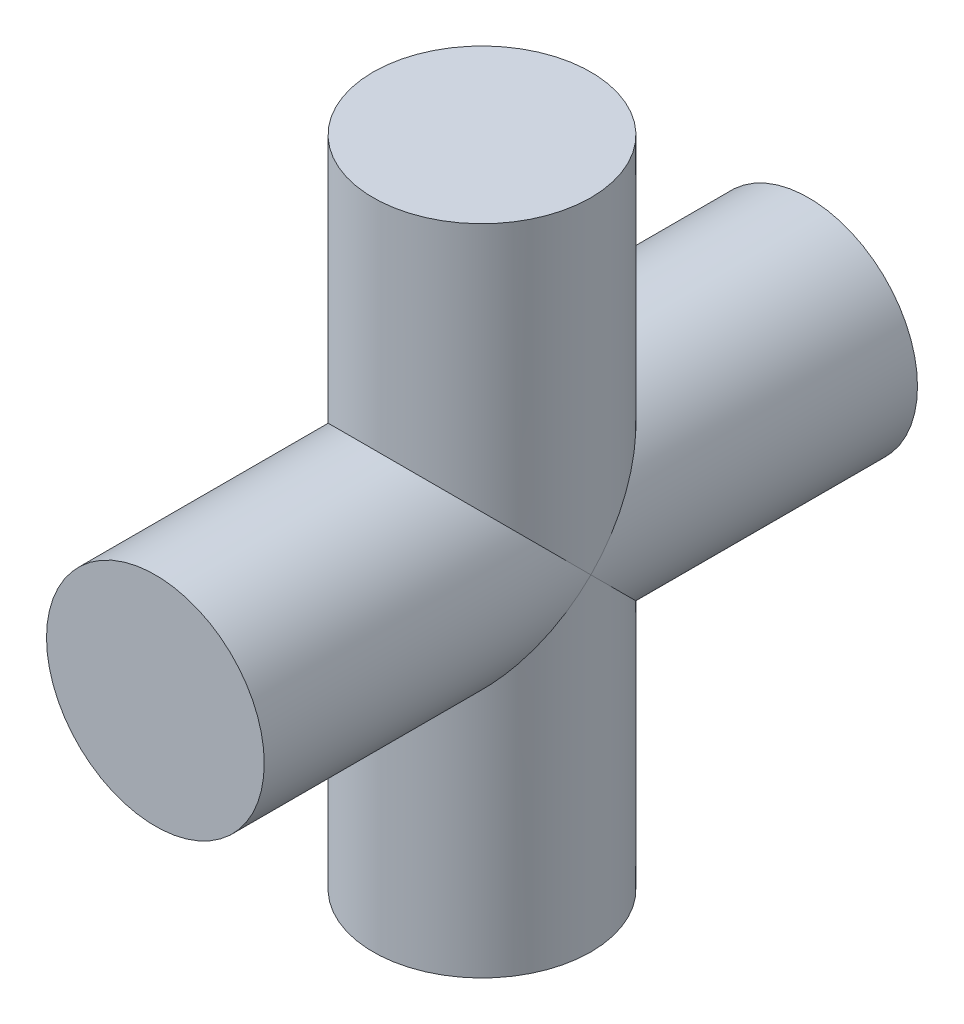
from build123d import *

# Parameters (mm, degrees)
SZKIC1_W = 11
SZKIC1_H = 66
SZKIC2_W = 11
SZKIC2_H = 66


with BuildPart() as part:
    # Szkic1 → Obrót1 (revolve)
    with BuildSketch(Plane.XY):
        with Locations((-5.5, 0)):
            Rectangle(SZKIC1_W, SZKIC1_H)
    revolve(axis=Axis((0, 33, 0), (0, -1, 0)))

    # Szkic2 → Obrót2 (revolve)
    with BuildSketch(Plane(origin=(0, 0, 0), x_dir=(1, 0, 0), z_dir=(0, 1, 0))):
        with Locations((-5.5, 0)):
            Rectangle(SZKIC2_W, SZKIC2_H)
    revolve(axis=Axis((0, 0, -33), (0, 0, 1)))


solid = part.part
